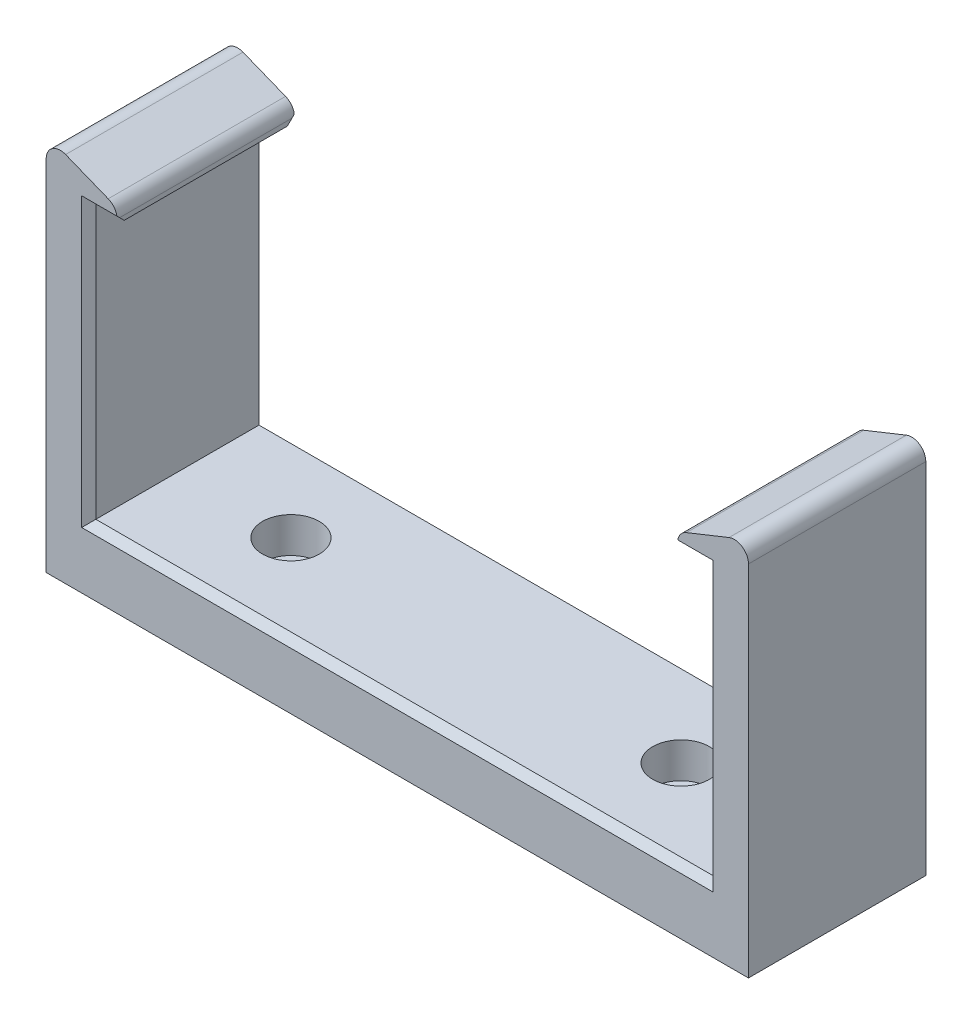
from build123d import *

# Parameters (mm, degrees)
BOSS_EXTRUDE1_DEPTH = 25
SKETCH3_R           = 2.1
CUT_EXTRUDE1_DEPTH  = 107.086049978
SKETCH3_3_R         = 4
SKETCH3_3_R_2       = 2.1
CUT_EXTRUDE2_DEPTH  = 5
FILLET1_R           = 2
CHAMFER1_SIZE       = 1


with BuildPart() as part:
    # Sketch2 → Boss-Extrude1 (new body)
    with BuildSketch(Plane.XY):
        Polygon((0, 0), (87, 0), (87, 38.5), (83, 38.5), (83, 40.5), (93, 44.5), (93, 38.5), (93, -10), (87, -10), (0, -10), (-6, -10), (-6, 38.5), (-6, 44.5), (4, 40.5), (4, 38.5), (0, 38.5), align=None)
    extrude(amount=BOSS_EXTRUDE1_DEPTH)

    # Sketch3 → Cut-Extrude1 (cut, through all)
    with BuildSketch(Plane(origin=(0, 0, 0), x_dir=(1, 0, 0), z_dir=(0, 1, 0))):
        with Locations((16, -12.5)):
            Circle(SKETCH3_R)
        with Locations((71, -12.5)):
            Circle(SKETCH3_R)
    extrude(amount=-CUT_EXTRUDE1_DEPTH, mode=Mode.SUBTRACT)

    # Sketch3<3> → Cut-Extrude2 (cut)
    # profile 1 of 2: a face of its own
    with BuildSketch(Plane(origin=(0, 0, 0), x_dir=(1, 0, 0), z_dir=(0, 1, 0))):
        with Locations((16, -12.5)):
            Circle(SKETCH3_3_R)
        with Locations((16, -12.5)):
            Circle(SKETCH3_3_R_2, mode=Mode.SUBTRACT)
    # profile 2 of 2: a face of its own
    with BuildSketch(Plane(origin=(0, 0, 0), x_dir=(1, 0, 0), z_dir=(0, 1, 0))):
        with Locations((71, -12.5)):
            Circle(SKETCH3_3_R)
        with Locations((71, -12.5)):
            Circle(SKETCH3_3_R_2, mode=Mode.SUBTRACT)
    extrude(amount=-CUT_EXTRUDE2_DEPTH, mode=Mode.SUBTRACT)

    # Fillet1
    fillet1_edges = [part.edges().sort_by_distance(p)[0] for p in [
        (-6, 44.5, 12.5),
        (93, 44.5, 12.5),
        (83, 40.5, 12.5),
        (4, 40.5, 12.5),
    ]]
    fillet(fillet1_edges, radius=FILLET1_R)

    # Chamfer1
    chamfer1_edges = [part.edges().sort_by_distance(p)[0] for p in [
        (2, 38.5, 25),
        (0, 19.25, 25),
        (85, 38.5, 25),
        (87, 19.25, 25),
        (43.5, 0, 25),
        (85, 38.5, 0),
        (87, 19.25, 0),
        (43.5, 0, 0),
        (2, 38.5, 0),
        (0, 19.25, 0),
        (93, -10, 12.5),
        (43.5, -10, 0),
        (-6, -10, 12.5),
        (43.5, -10, 25),
    ]]
    chamfer(chamfer1_edges, length=CHAMFER1_SIZE)


solid = part.part
